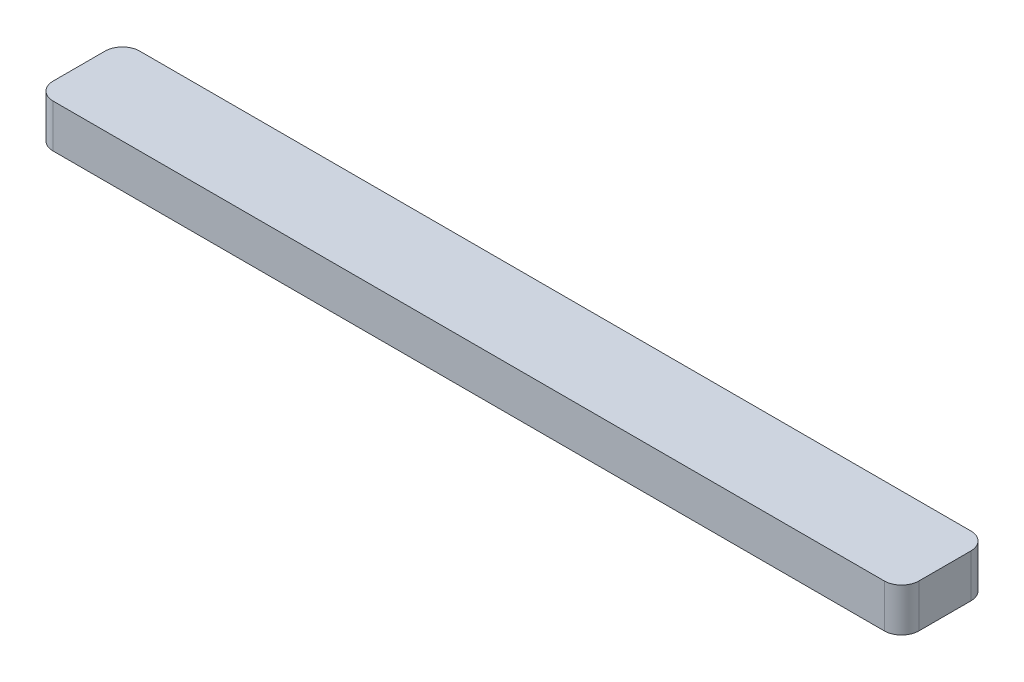
from build123d import *

# Parameters (mm, degrees)
RESSALTO_EXTRUS_O1_DEPTH = 5


with BuildPart() as part:
    # Esboço1 → Ressalto-extrusão1 (new body)
    with BuildSketch(Plane(origin=(0, 0, 0), x_dir=(1, 0, 0), z_dir=(0, 1, 0))):
        with BuildLine():
            Line((-48, 5), (48, 5))
            ThreePointArc((48, 5), (49.414213562, 4.414213562), (50, 3))
            Line((50, 3), (50, -3))
            ThreePointArc((50, -3), (49.414213562, -4.414213562), (48, -5))
            Line((48, -5), (-48, -5))
            ThreePointArc((-48, -5), (-49.414213562, -4.414213562), (-50, -3))
            Line((-50, -3), (-50, 3))
            ThreePointArc((-50, 3), (-49.414213562, 4.414213562), (-48, 5))
        make_face()
    extrude(amount=RESSALTO_EXTRUS_O1_DEPTH)


solid = part.part
